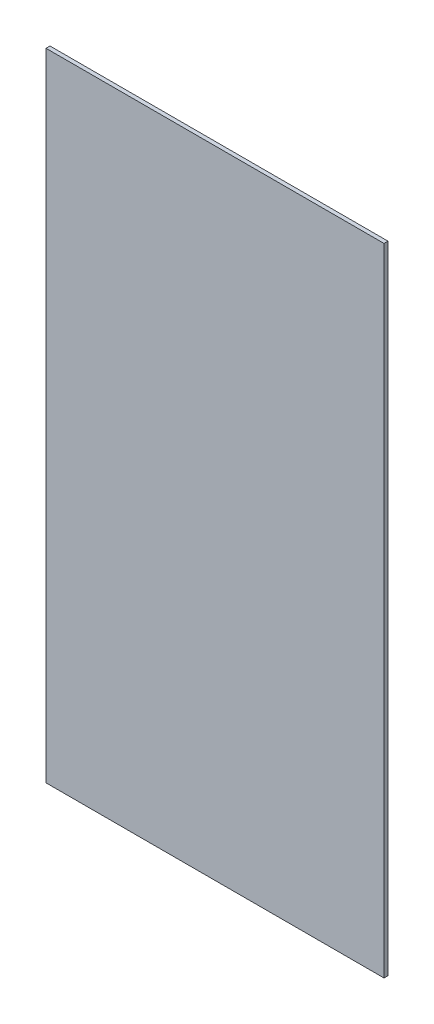
from build123d import *

# Parameters (mm, degrees)
CROQUIS1_W              = 170
CROQUIS1_H              = 320
SALIENTE_EXTRUIR1_DEPTH = 2


with BuildPart() as part:
    # Croquis1 → Saliente-Extruir1 (new body)
    with BuildSketch(Plane.XY):
        Rectangle(CROQUIS1_W, CROQUIS1_H)
    extrude(amount=SALIENTE_EXTRUIR1_DEPTH)


solid = part.part
